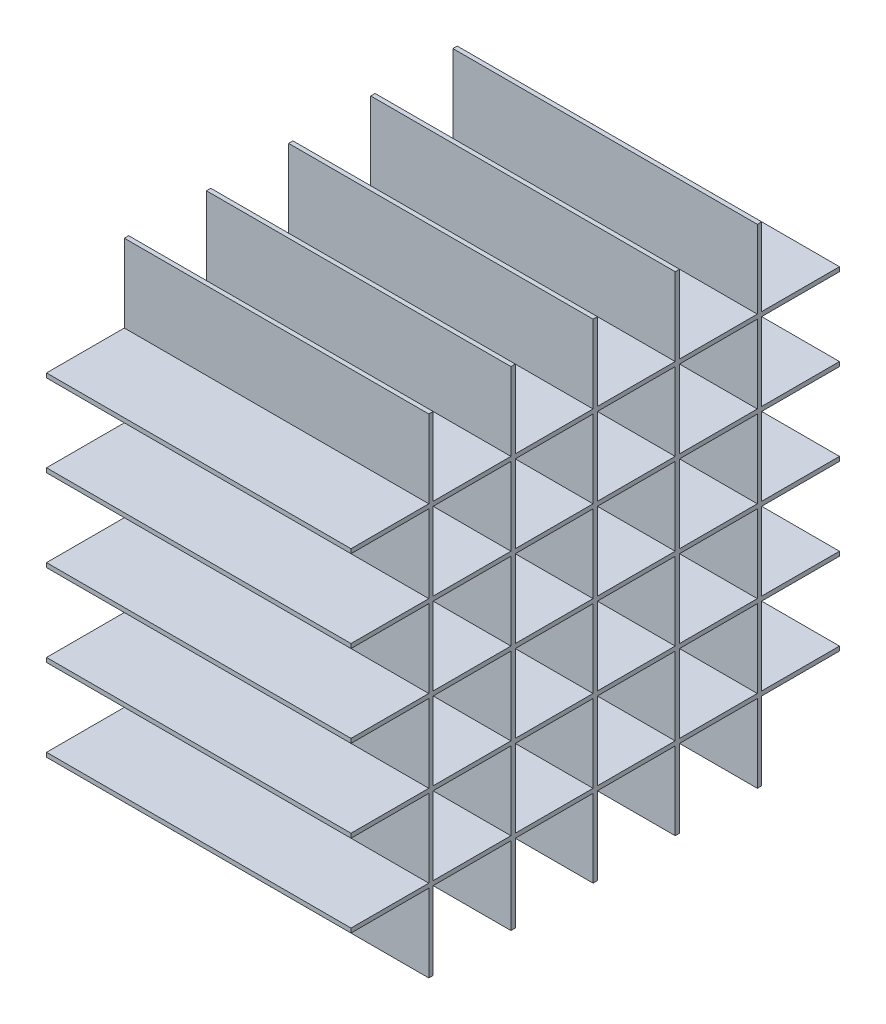
from build123d import *

# Parameters (mm, degrees)
SKETCH1_W               = 228.6
SKETCH1_H               = 228.6
BOSS_EXTRUDE1_DEPTH     = 140
SKETCH2_W               = 35.766
SKETCH2_H               = 35.766
CUT_EXTRUDE1_DEPTH      = 76.2
CUT_EXTRUDE3_DEPTH      = 4
CUT_EXTRUDE3_DEPTH_BACK = 4
SKETCH4_W               = 140
SKETCH4_H               = 35.766
CUT_EXTRUDE4_DEPTH      = 4
CUT_EXTRUDE4_DEPTH_BACK = 4
SKETCH5_W               = 140
SKETCH5_H               = 37.77
SKETCH5_H_2             = 35.766
CUT_EXTRUDE5_DEPTH      = 4
CUT_EXTRUDE5_DEPTH_BACK = 4
SKETCH6_W               = 140
SKETCH6_H               = 35.766
SKETCH6_H_2             = 37.77
CUT_EXTRUDE6_DEPTH      = 4
CUT_EXTRUDE6_DEPTH_BACK = 4
SKETCH9_W               = 140
SKETCH9_H               = 37.766
SKETCH9_H_2             = 35.766
SKETCH9_H_3             = 37.77
SKETCH10_W              = 140
SKETCH10_H              = 2
CUT_EXTRUDE7_DEPTH      = 263.834749521
SKETCH11_W              = 140
SKETCH11_H              = 2
CUT_EXTRUDE8_DEPTH      = 262.383356203
SKETCH12_W              = 33.77
SKETCH12_H              = 33.766
SKETCH12_W_2            = 35.766
SKETCH12_W_3            = 33.766
SKETCH12_H_2            = 35.766
SKETCH12_H_3            = 33.77
CUT_EXTRUDE9_DEPTH      = 177.150560601
SKETCH13_W              = 33.77
SKETCH13_H              = 35.766
SKETCH13_W_2            = 35.766
CUT_EXTRUDE10_DEPTH     = 177.150560601
SKETCH14_W              = 35.766
SKETCH14_H              = 35.766
CUT_EXTRUDE11_DEPTH     = 177.150560601


with BuildPart() as part:
    # Sketch1 → Boss-Extrude1 (new body)
    with BuildSketch(Plane(origin=(0, 0, 0), x_dir=(0, 0, -1), z_dir=(1, 0, 0))):
        Rectangle(SKETCH1_W, SKETCH1_H)
    extrude(amount=BOSS_EXTRUDE1_DEPTH)

    # Sketch2 → Cut-Extrude1 (cut)
    with BuildSketch(Plane(origin=(140, 0, 0), x_dir=(0, 0, -1), z_dir=(1, 0, 0))):
        with Locations((-94.417, 94.417)):
            Rectangle(SKETCH2_W, SKETCH2_H)
        with Locations((-56.651, 94.417)):
            Rectangle(SKETCH2_W, SKETCH2_H)
        with Locations((18.881, 94.417)):
            Rectangle(SKETCH2_W, SKETCH2_H)
        with Locations((-18.885, 94.417)):
            Rectangle(SKETCH2_W, SKETCH2_H)
        with Locations((56.647, 94.417)):
            Rectangle(SKETCH2_W, SKETCH2_H)
        with Locations((94.413, 94.417)):
            Rectangle(SKETCH2_W, SKETCH2_H)
        with Locations((56.647, 56.651)):
            Rectangle(SKETCH2_W, SKETCH2_H)
        with Locations((94.413, 56.651)):
            Rectangle(SKETCH2_W, SKETCH2_H)
        with Locations((18.881, 56.651)):
            Rectangle(SKETCH2_W, SKETCH2_H)
        with Locations((-18.885, 56.651)):
            Rectangle(SKETCH2_W, SKETCH2_H)
        with Locations((-56.651, 56.651)):
            Rectangle(SKETCH2_W, SKETCH2_H)
        with Locations((-94.417, 56.651)):
            Rectangle(SKETCH2_W, SKETCH2_H)
        with Locations((-94.417, 18.885)):
            Rectangle(SKETCH2_W, SKETCH2_H)
        with Locations((-56.651, 18.885)):
            Rectangle(SKETCH2_W, SKETCH2_H)
        with Locations((-18.885, 18.885)):
            Rectangle(SKETCH2_W, SKETCH2_H)
        with Locations((18.881, 18.885)):
            Rectangle(SKETCH2_W, SKETCH2_H)
        with Locations((56.647, 18.885)):
            Rectangle(SKETCH2_W, SKETCH2_H)
        with Locations((94.413, 18.885)):
            Rectangle(SKETCH2_W, SKETCH2_H)
        with Locations((94.413, -18.881)):
            Rectangle(SKETCH2_W, SKETCH2_H)
        with Locations((56.647, -18.881)):
            Rectangle(SKETCH2_W, SKETCH2_H)
        with Locations((18.881, -18.881)):
            Rectangle(SKETCH2_W, SKETCH2_H)
        with Locations((-18.885, -18.881)):
            Rectangle(SKETCH2_W, SKETCH2_H)
        with Locations((-56.651, -18.881)):
            Rectangle(SKETCH2_W, SKETCH2_H)
        with Locations((-94.417, -18.881)):
            Rectangle(SKETCH2_W, SKETCH2_H)
        with Locations((56.647, -56.647)):
            Rectangle(SKETCH2_W, SKETCH2_H)
        with Locations((94.413, -56.647)):
            Rectangle(SKETCH2_W, SKETCH2_H)
        with Locations((94.413, -94.413)):
            Rectangle(SKETCH2_W, SKETCH2_H)
        with Locations((56.647, -94.413)):
            Rectangle(SKETCH2_W, SKETCH2_H)
        with Locations((18.881, -94.413)):
            Rectangle(SKETCH2_W, SKETCH2_H)
        with Locations((18.881, -56.647)):
            Rectangle(SKETCH2_W, SKETCH2_H)
        with Locations((-18.885, -56.647)):
            Rectangle(SKETCH2_W, SKETCH2_H)
        with Locations((-18.885, -94.413)):
            Rectangle(SKETCH2_W, SKETCH2_H)
        with Locations((-56.651, -94.413)):
            Rectangle(SKETCH2_W, SKETCH2_H)
        with Locations((-56.651, -56.647)):
            Rectangle(SKETCH2_W, SKETCH2_H)
        with Locations((-94.417, -94.413)):
            Rectangle(SKETCH2_W, SKETCH2_H)
        with Locations((-94.417, -56.647)):
            Rectangle(SKETCH2_W, SKETCH2_H)
    extrude(amount=-CUT_EXTRUDE1_DEPTH, mode=Mode.SUBTRACT)

    # Sketch4 → Cut-Extrude3 (cut, two sides: drawn at the far end of the back side and taken through both)
    with BuildSketch(Plane(origin=(0, -114.3, 0), x_dir=(1, 0, 0), z_dir=(0, 1, 0)).offset(-CUT_EXTRUDE3_DEPTH_BACK)):
        with Locations((70, -94.417)):
            Rectangle(SKETCH4_W, SKETCH4_H)
        with Locations((70, -56.651)):
            Rectangle(SKETCH4_W, SKETCH4_H)
        with Locations((70, -18.885)):
            Rectangle(SKETCH4_W, SKETCH4_H)
        with Locations((70, 18.881)):
            Rectangle(SKETCH4_W, SKETCH4_H)
        with Locations((70, 56.647)):
            Rectangle(SKETCH4_W, SKETCH4_H)
        with Locations((70, 94.413)):
            Rectangle(SKETCH4_W, SKETCH4_H)
    extrude(amount=CUT_EXTRUDE3_DEPTH + CUT_EXTRUDE3_DEPTH_BACK, mode=Mode.SUBTRACT)

    # Sketch5 → Cut-Extrude4 (cut, two sides: drawn at the far end of the back side and taken through both)
    with BuildSketch(Plane.XY.offset(114.3).offset(-CUT_EXTRUDE4_DEPTH_BACK)):
        with Locations((70, -95.415)):
            Rectangle(SKETCH5_W, SKETCH5_H)
        with Locations((70, -56.647)):
            Rectangle(SKETCH5_W, SKETCH5_H_2)
        with Locations((70, -18.881)):
            Rectangle(SKETCH5_W, SKETCH5_H_2)
        with Locations((70, 18.885)):
            Rectangle(SKETCH5_W, SKETCH5_H_2)
        with Locations((70, 56.651)):
            Rectangle(SKETCH5_W, SKETCH5_H_2)
        with Locations((70, 94.417)):
            Rectangle(SKETCH5_W, SKETCH5_H_2)
    extrude(amount=CUT_EXTRUDE4_DEPTH + CUT_EXTRUDE4_DEPTH_BACK, mode=Mode.SUBTRACT)

    # Sketch6 → Cut-Extrude5 (cut, two sides: drawn at the far end of the back side and taken through both)
    with BuildSketch(Plane.XY.offset(-114.3).offset(-CUT_EXTRUDE5_DEPTH_BACK)):
        with Locations((70, 94.417)):
            Rectangle(SKETCH6_W, SKETCH6_H)
        with Locations((70, 56.651)):
            Rectangle(SKETCH6_W, SKETCH6_H)
        with Locations((70, 18.885)):
            Rectangle(SKETCH6_W, SKETCH6_H)
        with Locations((70, -18.881)):
            Rectangle(SKETCH6_W, SKETCH6_H)
        with Locations((70, -56.647)):
            Rectangle(SKETCH6_W, SKETCH6_H)
        with Locations((70, -95.415)):
            Rectangle(SKETCH6_W, SKETCH6_H_2)
    extrude(amount=CUT_EXTRUDE5_DEPTH + CUT_EXTRUDE5_DEPTH_BACK, mode=Mode.SUBTRACT)

    # Sketch9 → Cut-Extrude6 (cut, two sides: drawn at the far end of the back side and taken through both)
    with BuildSketch(Plane(origin=(0, 114.3, 0), x_dir=(1, 0, 0), z_dir=(0, 1, 0)).offset(-CUT_EXTRUDE6_DEPTH_BACK)):
        with Locations((70, -95.417)):
            Rectangle(SKETCH9_W, SKETCH9_H)
        with Locations((70, -56.651)):
            Rectangle(SKETCH9_W, SKETCH9_H_2)
        with Locations((70, -18.885)):
            Rectangle(SKETCH9_W, SKETCH9_H_2)
        with Locations((70, 18.881)):
            Rectangle(SKETCH9_W, SKETCH9_H_2)
        with Locations((70, 56.647)):
            Rectangle(SKETCH9_W, SKETCH9_H_2)
        with Locations((70, 95.415)):
            Rectangle(SKETCH9_W, SKETCH9_H_3)
    extrude(amount=CUT_EXTRUDE6_DEPTH + CUT_EXTRUDE6_DEPTH_BACK, mode=Mode.SUBTRACT)

    # Sketch10 → Cut-Extrude7 (cut, through all)
    with BuildSketch(Plane.XY.offset(76.534)):
        with Locations((70, -113.3)):
            Rectangle(SKETCH10_W, SKETCH10_H)
        with Locations((70, 113.3)):
            Rectangle(SKETCH10_W, SKETCH10_H)
    extrude(amount=-CUT_EXTRUDE7_DEPTH, mode=Mode.SUBTRACT)

    # Sketch11 → Cut-Extrude8 (cut, through all)
    with BuildSketch(Plane(origin=(0, -76.53, 0), x_dir=(-1, 0, 0), z_dir=(0, -1, 0))):
        with Locations((-70, 113.3)):
            Rectangle(SKETCH11_W, SKETCH11_H)
        with Locations((-70, -113.3)):
            Rectangle(SKETCH11_W, SKETCH11_H)
    extrude(amount=-CUT_EXTRUDE8_DEPTH, mode=Mode.SUBTRACT)

    # Sketch12 → Cut-Extrude9 (cut, through all)
    with BuildSketch(Plane(origin=(63.8, 0, 0), x_dir=(0, 0, -1), z_dir=(1, 0, 0))):
        with Locations((93.415, 93.417)):
            Rectangle(SKETCH12_W, SKETCH12_H)
        with Locations((56.647, 93.417)):
            Rectangle(SKETCH12_W_2, SKETCH12_H)
        with Locations((-18.885, 93.417)):
            Rectangle(SKETCH12_W_2, SKETCH12_H)
        with Locations((18.881, 93.417)):
            Rectangle(SKETCH12_W_2, SKETCH12_H)
        with Locations((-56.651, 93.417)):
            Rectangle(SKETCH12_W_2, SKETCH12_H)
        with Locations((-93.417, 93.417)):
            Rectangle(SKETCH12_W_3, SKETCH12_H)
        with Locations((-93.417, 56.651)):
            Rectangle(SKETCH12_W_3, SKETCH12_H_2)
        with Locations((-93.417, 18.885)):
            Rectangle(SKETCH12_W_3, SKETCH12_H_2)
        with Locations((-93.417, -18.881)):
            Rectangle(SKETCH12_W_3, SKETCH12_H_2)
        with Locations((-93.417, -56.647)):
            Rectangle(SKETCH12_W_3, SKETCH12_H_2)
        with Locations((-93.417, -93.415)):
            Rectangle(SKETCH12_W_3, SKETCH12_H_3)
        with Locations((-56.651, -93.415)):
            Rectangle(SKETCH12_W_2, SKETCH12_H_3)
        with Locations((-18.885, -93.415)):
            Rectangle(SKETCH12_W_2, SKETCH12_H_3)
        with Locations((18.881, -93.415)):
            Rectangle(SKETCH12_W_2, SKETCH12_H_3)
        with Locations((56.647, -93.415)):
            Rectangle(SKETCH12_W_2, SKETCH12_H_3)
        with Locations((93.415, -93.415)):
            Rectangle(SKETCH12_W, SKETCH12_H_3)
        with Locations((93.415, -56.647)):
            Rectangle(SKETCH12_W, SKETCH12_H_2)
        with Locations((93.415, -18.881)):
            Rectangle(SKETCH12_W, SKETCH12_H_2)
    extrude(amount=-CUT_EXTRUDE9_DEPTH, mode=Mode.SUBTRACT)

    # Sketch13 → Cut-Extrude10 (cut, through all)
    with BuildSketch(Plane(origin=(63.8, 0, 0), x_dir=(0, 0, -1), z_dir=(1, 0, 0))):
        with Locations((93.415, 18.885)):
            Rectangle(SKETCH13_W, SKETCH13_H)
        with Locations((93.415, 56.651)):
            Rectangle(SKETCH13_W, SKETCH13_H)
        with Locations((56.647, 56.651)):
            Rectangle(SKETCH13_W_2, SKETCH13_H)
        with Locations((18.881, 56.651)):
            Rectangle(SKETCH13_W_2, SKETCH13_H)
        with Locations((18.881, 18.885)):
            Rectangle(SKETCH13_W_2, SKETCH13_H)
        with Locations((56.647, 18.885)):
            Rectangle(SKETCH13_W_2, SKETCH13_H)
        with Locations((-18.885, 18.885)):
            Rectangle(SKETCH13_W_2, SKETCH13_H)
        with Locations((-56.651, 18.885)):
            Rectangle(SKETCH13_W_2, SKETCH13_H)
        with Locations((-56.651, -18.881)):
            Rectangle(SKETCH13_W_2, SKETCH13_H)
        with Locations((-56.651, -56.647)):
            Rectangle(SKETCH13_W_2, SKETCH13_H)
        with Locations((18.881, -56.647)):
            Rectangle(SKETCH13_W_2, SKETCH13_H)
        with Locations((-18.885, -56.647)):
            Rectangle(SKETCH13_W_2, SKETCH13_H)
        with Locations((56.647, -56.647)):
            Rectangle(SKETCH13_W_2, SKETCH13_H)
        with Locations((56.647, -18.881)):
            Rectangle(SKETCH13_W_2, SKETCH13_H)
    extrude(amount=-CUT_EXTRUDE10_DEPTH, mode=Mode.SUBTRACT)

    # Sketch14 → Cut-Extrude11 (cut, through all)
    with BuildSketch(Plane(origin=(63.8, 0, 0), x_dir=(0, 0, -1), z_dir=(1, 0, 0))):
        with Locations((18.881, -18.881)):
            Rectangle(SKETCH14_W, SKETCH14_H)
        with Locations((-18.885, -18.881)):
            Rectangle(SKETCH14_W, SKETCH14_H)
        with Locations((-18.885, 56.651)):
            Rectangle(SKETCH14_W, SKETCH14_H)
        with Locations((-56.651, 56.651)):
            Rectangle(SKETCH14_W, SKETCH14_H)
    extrude(amount=-CUT_EXTRUDE11_DEPTH, mode=Mode.SUBTRACT)


solid = part.part
